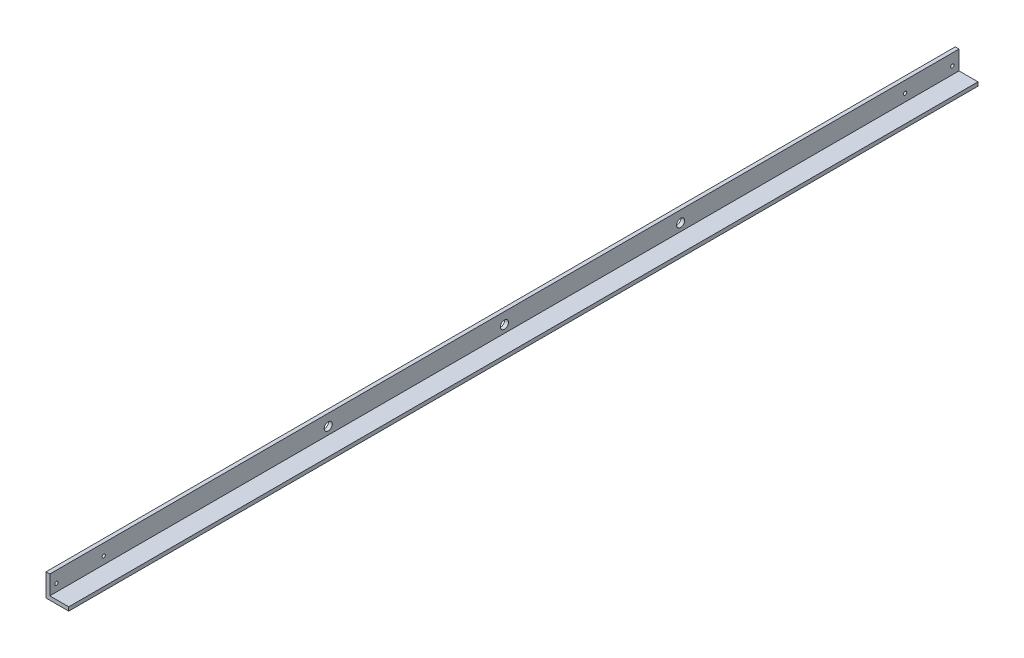
from build123d import *

# Parameters (mm, degrees)
BOSS_EXTRUDE1_DEPTH                  = 762
F_35_0_11_DIAMETER_HOLE1_D           = 2.794
F_17_64_0_26563_DIAMETER_HOLE1_D     = 6.747002
F_17_64_0_26563_DIAMETER_HOLE1_DEPTH = 10
F_17_64_0_26563_DIAMETER_HOLE1_TIP   = 2.027003899


with BuildPart() as part:
    # Sketch1 → Boss-Extrude1 (new body)
    with BuildSketch(Plane.XY):
        Polygon((0, 0), (19.05, 0), (19.05, 3.175), (3.175, 3.175), (3.175, 19.05), (0, 19.05), align=None)
    extrude(amount=BOSS_EXTRUDE1_DEPTH)

    # #35 (0.11) Diameter Hole1 (through all)
    with Locations(Plane(origin=(0, 9.525, 5.588), x_dir=(0, -1, 0), z_dir=(-1, 0, 0))):
        with Locations((0, 0), (0, 39.624), (0, 711.199), (0, 750.824)):
            Hole(F_35_0_11_DIAMETER_HOLE1_D / 2)

    # 17/64 (0.26563) Diameter Hole1
    with Locations(Plane(origin=(0, 9.525, 233.3625), x_dir=(0, -1, 0), z_dir=(-1, 0, 0))):
        with Locations((0, 0), (0, 147.6375), (0, 295.275)):
            Hole(F_17_64_0_26563_DIAMETER_HOLE1_D / 2, depth=F_17_64_0_26563_DIAMETER_HOLE1_DEPTH)
            with Locations((0, 0, -(F_17_64_0_26563_DIAMETER_HOLE1_DEPTH + F_17_64_0_26563_DIAMETER_HOLE1_TIP / 2))):  # 118° drill point
                Cone(0, F_17_64_0_26563_DIAMETER_HOLE1_D / 2, F_17_64_0_26563_DIAMETER_HOLE1_TIP, mode=Mode.SUBTRACT)


solid = part.part
